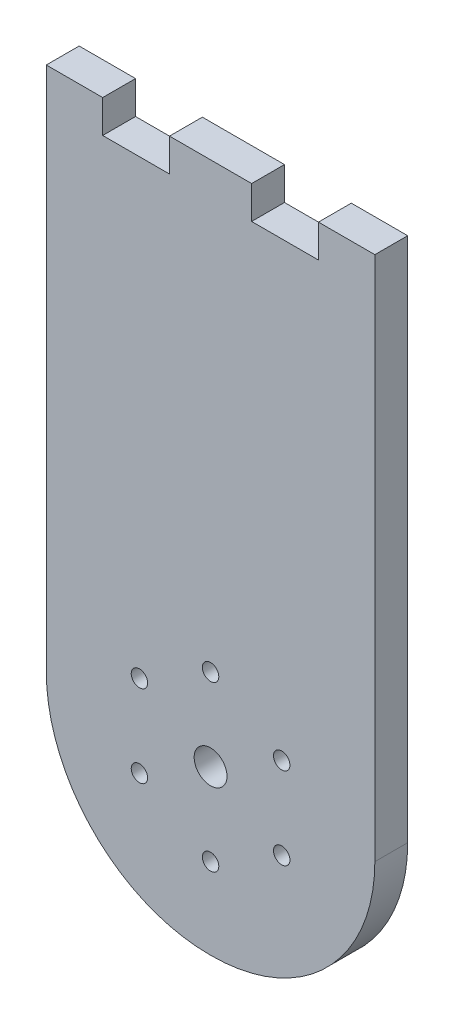
from build123d import *

# Parameters (mm, degrees)
SKETCH2_R           = 0.75
SKETCH2_R_2         = 1.5
BOSS_EXTRUDE1_DEPTH = 3


with BuildPart() as part:
    # Sketch2 → Boss-Extrude1 (new body)
    with BuildSketch(Plane.XY):
        with BuildLine():
            Line((-9.85, 31.45), (-9.85, 28.45))
            Line((-9.85, 28.45), (-3.75, 28.45))
            Line((-3.75, 28.45), (-3.75, 31.45))
            Line((-3.75, 31.45), (3.75, 31.45))
            Line((3.75, 31.45), (3.75, 28.45))
            Line((3.75, 28.45), (9.85, 28.45))
            Line((9.85, 28.45), (9.85, 31.45))
            Line((9.85, 31.45), (15, 31.45))
            Line((15, 31.45), (15, -16.55))
            ThreePointArc((15, -16.55), (10.63589104, -27.08589104), (0.1, -31.45))
            Line((0.1, -31.45), (-0.1, -31.45))
            ThreePointArc((-0.1, -31.45), (-10.63589104, -27.08589104), (-15, -16.55))
            Line((-15, -16.55), (-15, 31.45))
            Line((-15, 31.45), (-9.85, 31.45))
        make_face()
        with Locations((0, -9.05)):
            Circle(SKETCH2_R, mode=Mode.SUBTRACT)
        with Locations((6.495190528, -12.8)):
            Circle(SKETCH2_R, mode=Mode.SUBTRACT)
        with Locations((6.495190528, -20.3)):
            Circle(SKETCH2_R, mode=Mode.SUBTRACT)
        with Locations((0, -24.05)):
            Circle(SKETCH2_R, mode=Mode.SUBTRACT)
        with Locations((-6.495190528, -20.3)):
            Circle(SKETCH2_R, mode=Mode.SUBTRACT)
        with Locations((-6.495190528, -12.8)):
            Circle(SKETCH2_R, mode=Mode.SUBTRACT)
        with Locations((0, -16.55)):
            Circle(SKETCH2_R_2, mode=Mode.SUBTRACT)
    extrude(amount=BOSS_EXTRUDE1_DEPTH)


solid = part.part
